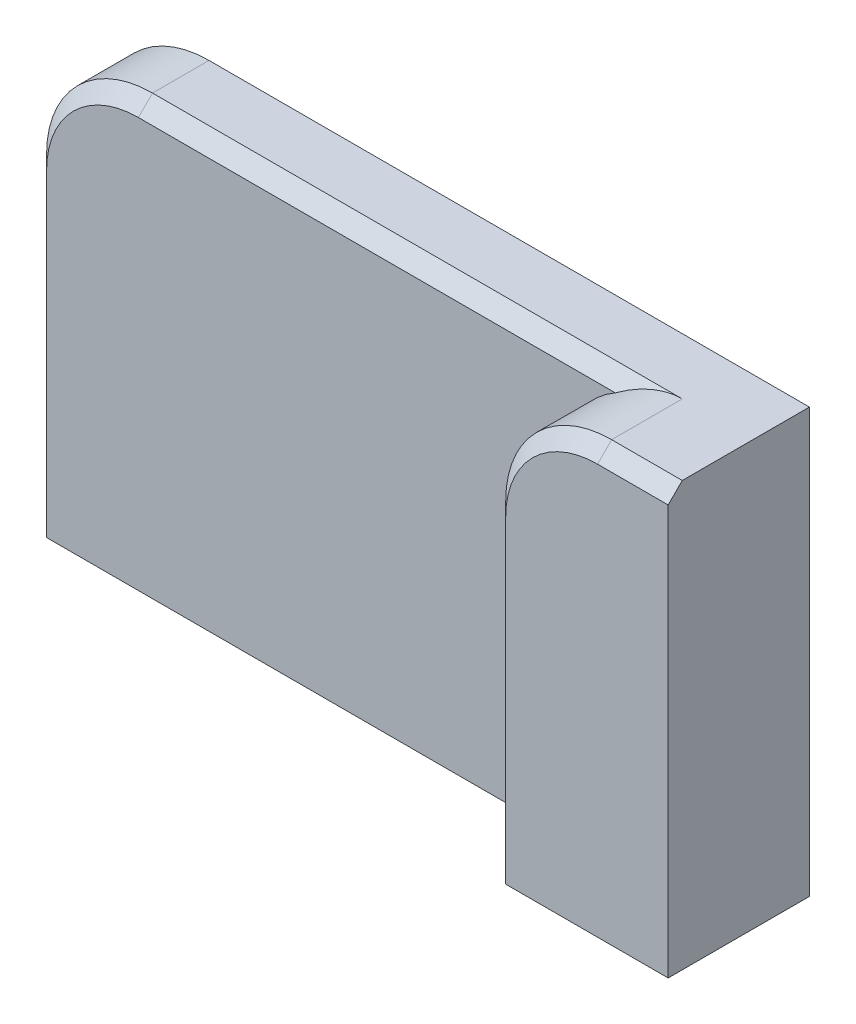
from build123d import *

# Parameters (mm, degrees)
SKETCH1_W           = 5
SKETCH1_H           = 3
BOSS_EXTRUDE1_DEPTH = 0.5
SKETCH2_W           = 1.25
SKETCH2_H           = 3
BOSS_EXTRUDE3_DEPTH = 0.5
FILLET1_R           = 0.75
CHAMFER1_SIZE       = 0.1


with BuildPart() as part:
    # Sketch1 → Boss-Extrude1 (new body)
    with BuildSketch(Plane.XY):
        with Locations((2.5, 1.5)):
            Rectangle(SKETCH1_W, SKETCH1_H)
    extrude(amount=BOSS_EXTRUDE1_DEPTH)

    # Sketch2 → Boss-Extrude3 (add)
    with BuildSketch(Plane.XY.offset(0.5)):
        with Locations((4.375, 1.5)):
            Rectangle(SKETCH2_W, SKETCH2_H)
    extrude(amount=BOSS_EXTRUDE3_DEPTH)

    # Fillet1
    fillet1_edges = [part.edges().sort_by_distance(p)[0] for p in [
        (3.75, 3, 0.75),
        (0, 3, 0.25),
    ]]
    fillet(fillet1_edges, radius=FILLET1_R)

    # Chamfer1
    chamfer1_edges = [part.edges().sort_by_distance(p)[0] for p in [
        (2.625, 3, 0.5),
        (4.75, 3, 1),
        (3.75, 1.125, 1),
        (3.969669914, 2.780330086, 1),
        (0, 1.125, 0.5),
        (0.219669914, 2.780330086, 0.5),
    ]]
    chamfer(chamfer1_edges, length=CHAMFER1_SIZE)


solid = part.part
